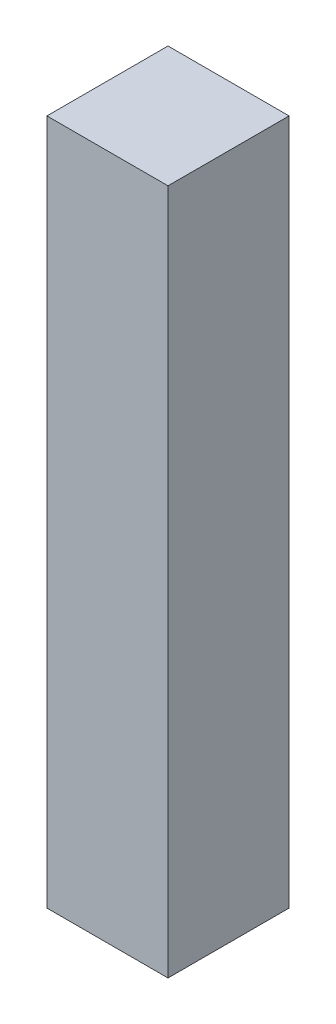
from build123d import *

# Parameters (mm, degrees)
SKETCH1_W           = 300
SKETCH1_H           = 300
BOSS_EXTRUDE1_DEPTH = 1700


with BuildPart() as part:
    # Sketch1 → Boss-Extrude1 (new body)
    with BuildSketch(Plane(origin=(0, 0, 0), x_dir=(1, 0, 0), z_dir=(0, 1, 0))):
        with Locations((-330.208333333, 85.416666667)):
            Rectangle(SKETCH1_W, SKETCH1_H)
    extrude(amount=BOSS_EXTRUDE1_DEPTH)


solid = part.part
